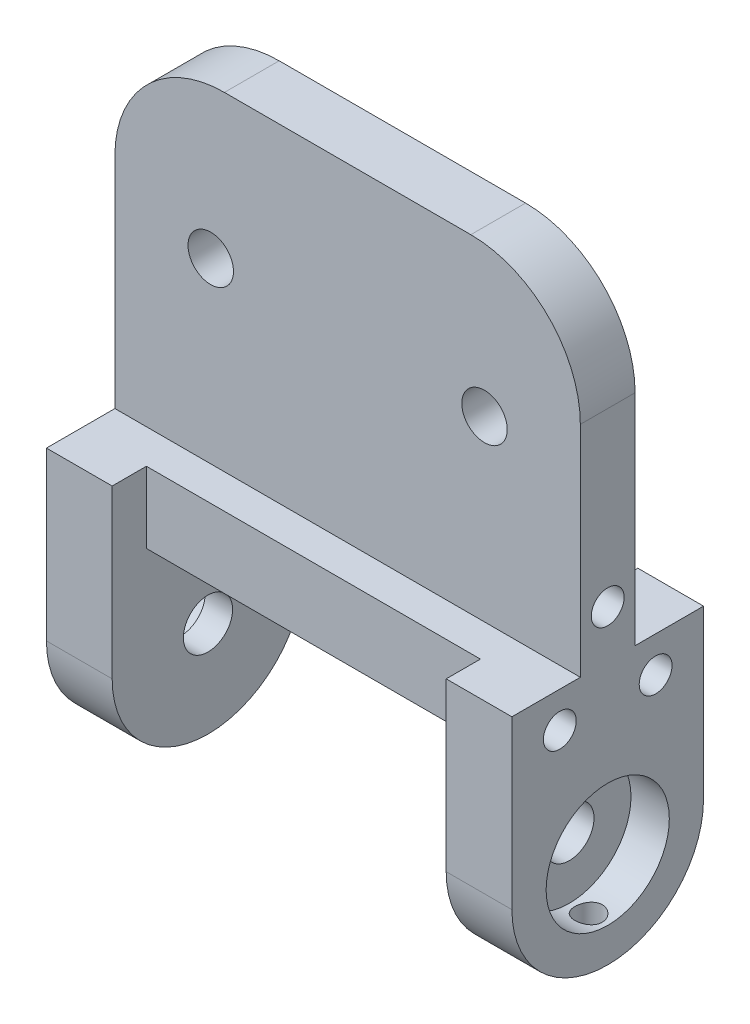
from build123d import *

# Parameters (mm, degrees)
SKETCH1_W           = 85
SKETCH1_H           = 10
BOSS_EXTRUDE1_DEPTH = 60
SKETCH2_R           = 4.15
CUT_EXTRUDE1_DEPTH  = 75.204110398
SKETCH3_W           = 85
SKETCH3_H           = 35
BOSS_EXTRUDE2_DEPTH = 13
SKETCH4_R           = 11.25
BOSS_EXTRUDE4_DEPTH = 12
BOSS_EXTRUDE5_START = -5
SKETCH5_R           = 11.25
SKETCH5_R_2         = 4.5
BOSS_EXTRUDE5_DEPTH = 5
SKETCH6_R           = 3
CUT_EXTRUDE2_DEPTH  = 10
SKETCH7_R           = 2.5
CUT_EXTRUDE3_DEPTH  = 10
FILLET2_R           = 20
SKETCH8_W           = 61
SKETCH8_H           = 6.25
CUT_EXTRUDE4_DEPTH  = 20


with BuildPart() as part:
    # Sketch1 → Boss-Extrude1 (new body)
    with BuildSketch(Plane(origin=(0, 0, 0), x_dir=(1, 0, 0), z_dir=(0, 1, 0))):
        Rectangle(SKETCH1_W, SKETCH1_H)
    extrude(amount=BOSS_EXTRUDE1_DEPTH)

    # Sketch2 → Cut-Extrude1 (cut, through all)
    with BuildSketch(Plane.XY.offset(5)):
        with Locations((-25, 32.5)):
            Circle(SKETCH2_R)
        with Locations((25, 32.5)):
            Circle(SKETCH2_R)
    extrude(amount=-CUT_EXTRUDE1_DEPTH, mode=Mode.SUBTRACT)

    # Sketch3 → Boss-Extrude2 (add)
    with BuildSketch(Plane.XZ):
        Rectangle(SKETCH3_W, SKETCH3_H)
    extrude(amount=BOSS_EXTRUDE2_DEPTH)

    # Sketch4 → Boss-Extrude4 (add)
    with BuildSketch(Plane.ZY.offset(42.5)):
        with BuildLine():
            Line((-17.5, -13), (-17.5, -30.5))
            ThreePointArc((-17.5, -30.5), (0, -48), (17.5, -30.5))
            Line((17.5, -30.5), (17.5, -13))
            Line((17.5, -13), (-17.5, -13))
        make_face()
        with Locations((0, -30.5)):
            Circle(SKETCH4_R, mode=Mode.SUBTRACT)
    boss_extrude4 = extrude(amount=-BOSS_EXTRUDE4_DEPTH)

    # Sketch5 → Boss-Extrude5 (add)
    with BuildSketch(Plane(origin=(-30.5, 0, 0), x_dir=(0, 0, -1), z_dir=(1, 0, 0)).offset(BOSS_EXTRUDE5_START)):
        with Locations(Location((0, -30.5, 0), (0, 0, 180))):
            Circle(SKETCH5_R)
        with Locations((0, -30.5)):
            Circle(SKETCH5_R_2, mode=Mode.SUBTRACT)
    boss_extrude5 = extrude(amount=BOSS_EXTRUDE5_DEPTH)

    # Sketch6 → Cut-Extrude2 (cut)
    with BuildSketch(Plane.ZY.offset(42.5)):
        with Locations((-8.75, -6.5)):
            Circle(SKETCH6_R)
        with Locations((8.75, -6.5)):
            Circle(SKETCH6_R)
        with Locations((0, 8.655444566)):
            Circle(SKETCH6_R)
    cut_extrude2 = extrude(amount=-CUT_EXTRUDE2_DEPTH, mode=Mode.SUBTRACT)

    # Mirror2: Boss-Extrude4, Boss-Extrude5, Cut-Extrude2 across plane
    add(boss_extrude4.mirror(Plane(origin=(0, 0, 0), x_dir=(0, 0, 1), z_dir=(1, 0, 0))))
    add(boss_extrude5.mirror(Plane(origin=(0, 0, 0), x_dir=(0, 0, 1), z_dir=(1, 0, 0))))
    add(cut_extrude2.mirror(Plane(origin=(0, 0, 0), x_dir=(0, 0, 1), z_dir=(1, 0, 0))), mode=Mode.SUBTRACT)

    # Sketch7 → Cut-Extrude3 (cut)
    with BuildSketch(Plane(origin=(0, -48, 0), x_dir=(-1, 0, 0), z_dir=(0, -1, 0))):
        with Locations(Location((-39, 0, 0), (0, 0, 90))):
            Circle(SKETCH7_R)
        with Locations(Location((39, 0, 0), (0, 0, 90))):
            Circle(SKETCH7_R)
    extrude(amount=-CUT_EXTRUDE3_DEPTH, mode=Mode.SUBTRACT)

    # Fillet2
    fillet2_edges = [part.edges().sort_by_distance(p)[0] for p in [
        (42.5, 60, 0),
        (-42.5, 60, 0),
    ]]
    fillet(fillet2_edges, radius=FILLET2_R)

    # Sketch8 → Cut-Extrude4 (cut)
    with BuildSketch(Plane.XZ.offset(13)):
        with Locations((0, 14.375)):
            Rectangle(SKETCH8_W, SKETCH8_H)
        with Locations((0, -14.375)):
            Rectangle(SKETCH8_W, SKETCH8_H)
    extrude(amount=-CUT_EXTRUDE4_DEPTH, mode=Mode.SUBTRACT)


solid = part.part
